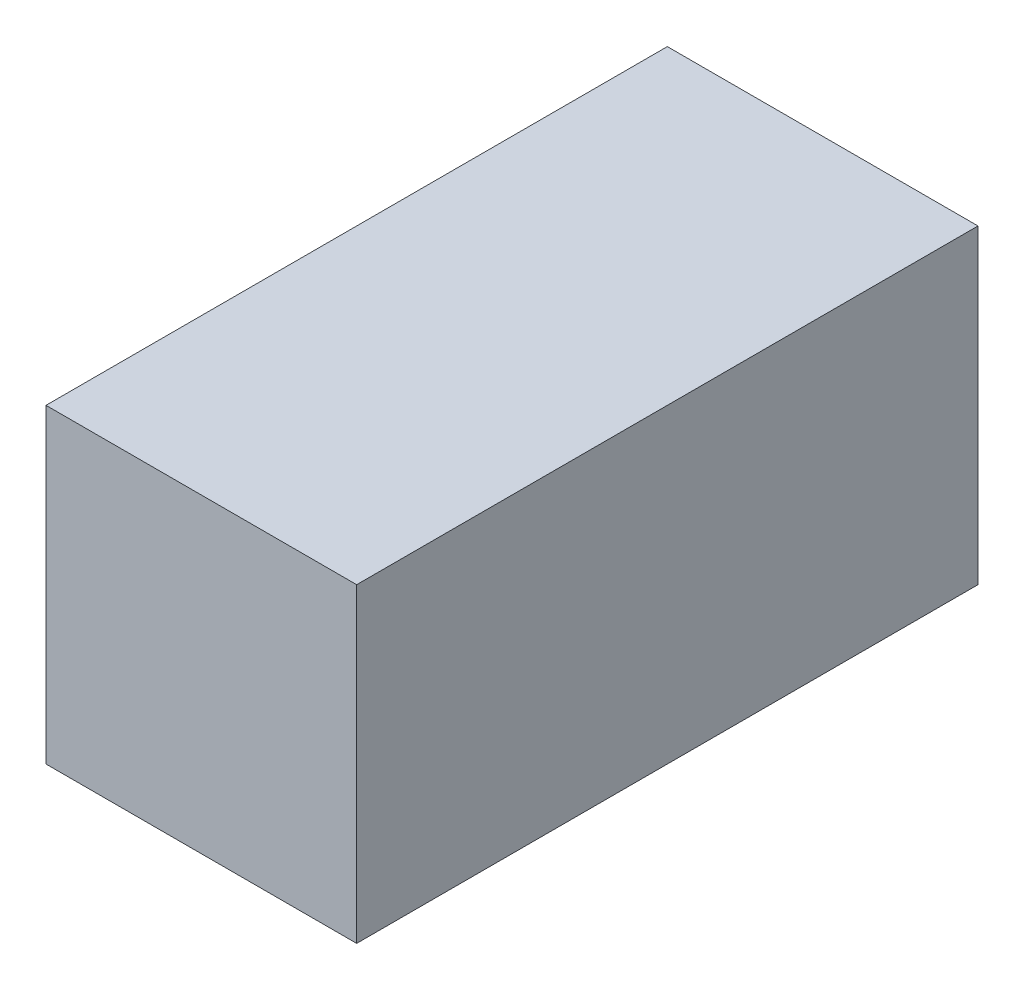
from build123d import *

# Parameters (mm, degrees)
ESQUISSE1_W                = 100
ESQUISSE1_H                = 100
BOSS_EXTRU_1_DEPTH         = 200
ESQUISSE2_W                = 80
ESQUISSE2_H                = 180
ENL_V_MAT_EXTRU_1_DEPTH    = 15
ESQUISSE3_W                = 15
ESQUISSE3_H                = 15
BOSS_EXTRU_2_DEPTH         = 80
R_P_TITION_LIN_AIRE1_COUNT = 6
R_P_TITION_LIN_AIRE1_PITCH = 20
ESQUISSE4_W                = 50
ESQUISSE4_H                = 5
ESQUISSE4_W_2              = 7
ESQUISSE4_H_2              = 4
ENL_V_MAT_EXTRU_2_DEPTH    = 2
R_P_TITION_LIN_AIRE2_COUNT = 6
R_P_TITION_LIN_AIRE2_PITCH = 20
ESQUISSE5_W                = 25
ESQUISSE5_H                = 15
BOSS_EXTRU_3_DEPTH         = 60
ESQUISSE6_W                = 15
ESQUISSE6_H                = 15
BOSS_EXTRU_4_DEPTH         = 50
R_P_TITION_LIN_AIRE3_COUNT = 2
R_P_TITION_LIN_AIRE3_PITCH = 30
ESQUISSE7_W                = 6
ESQUISSE7_H                = 45
ESQUISSE7_W_2              = 35
ESQUISSE7_H_2              = 5
ENL_V_MAT_EXTRU_3_DEPTH    = 3


with BuildPart() as part:
    # Esquisse1 → Boss.-Extru.1 (new body)
    with BuildSketch(Plane.XY):
        Rectangle(ESQUISSE1_W, ESQUISSE1_H)
    extrude(amount=BOSS_EXTRU_1_DEPTH)

    # Esquisse2 → Enlèv. mat.-Extru.1 (cut)
    with BuildSketch(Plane.XZ.offset(50)):
        with Locations((0, 100)):
            Rectangle(ESQUISSE2_W, ESQUISSE2_H)
    extrude(amount=-ENL_V_MAT_EXTRU_1_DEPTH, mode=Mode.SUBTRACT)

    # Esquisse3 → Boss.-Extru.2 (add)
    with BuildSketch(Plane(origin=(-40, 0, 0), x_dir=(0, 0, -1), z_dir=(1, 0, 0))):
        with Locations((-177.5, -42.5)):
            Rectangle(ESQUISSE3_W, ESQUISSE3_H)
    boss_extru_2 = extrude(amount=BOSS_EXTRU_2_DEPTH)

    # Répétition linéaire1: Boss.-Extru.2 ×6
    with Locations(*[(0, 0, -i * R_P_TITION_LIN_AIRE1_PITCH) for i in range(1, R_P_TITION_LIN_AIRE1_COUNT)]):
        add(boss_extru_2)

    # Esquisse4 → Enlèv. mat.-Extru.2 (cut)
    with BuildSketch(Plane.XZ.offset(50)):
        with Locations((-15, 177.5)):
            Rectangle(ESQUISSE4_W, ESQUISSE4_H)
        with Locations((21.5, 181)):
            Rectangle(ESQUISSE4_W_2, ESQUISSE4_H_2)
        with Locations((21.5, 174)):
            Rectangle(ESQUISSE4_W_2, ESQUISSE4_H_2)
    enl_v_mat_extru_2 = extrude(amount=-ENL_V_MAT_EXTRU_2_DEPTH, mode=Mode.SUBTRACT)

    # Répétition linéaire2: Enlèv. mat.-Extru.2 ×6
    with Locations(*[(0, 0, -i * R_P_TITION_LIN_AIRE2_PITCH) for i in range(1, R_P_TITION_LIN_AIRE2_COUNT)]):
        add(enl_v_mat_extru_2, mode=Mode.SUBTRACT)

    # Esquisse5 → Boss.-Extru.3 (add)
    with BuildSketch(Plane(origin=(0, 0, 70), x_dir=(-1, 0, 0), z_dir=(0, 0, -1))):
        with Locations((22.5, -42.5)):
            Rectangle(ESQUISSE5_W, ESQUISSE5_H)
    extrude(amount=BOSS_EXTRU_3_DEPTH)

    # Esquisse6 → Boss.-Extru.4 (add)
    with BuildSketch(Plane(origin=(-10, 0, 0), x_dir=(0, 0, -1), z_dir=(1, 0, 0))):
        with Locations((-57.5, -42.5)):
            Rectangle(ESQUISSE6_W, ESQUISSE6_H)
    boss_extru_4 = extrude(amount=BOSS_EXTRU_4_DEPTH)

    # Répétition linéaire3: Boss.-Extru.4 ×2
    with Locations(*[(0, 0, -i * R_P_TITION_LIN_AIRE3_PITCH) for i in range(1, R_P_TITION_LIN_AIRE3_COUNT)]):
        add(boss_extru_4)

    # Esquisse7 → Enlèv. mat.-Extru.3 (cut)
    with BuildSketch(Plane.XZ.offset(50)):
        with Locations((-26, 32.5)):
            Rectangle(ESQUISSE7_W, ESQUISSE7_H)
        with Locations((7.5, 57.5)):
            Rectangle(ESQUISSE7_W_2, ESQUISSE7_H_2)
        with Locations((7.5, 27.5)):
            Rectangle(ESQUISSE7_W_2, ESQUISSE7_H_2)
    extrude(amount=-ENL_V_MAT_EXTRU_3_DEPTH, mode=Mode.SUBTRACT)


solid = part.part
